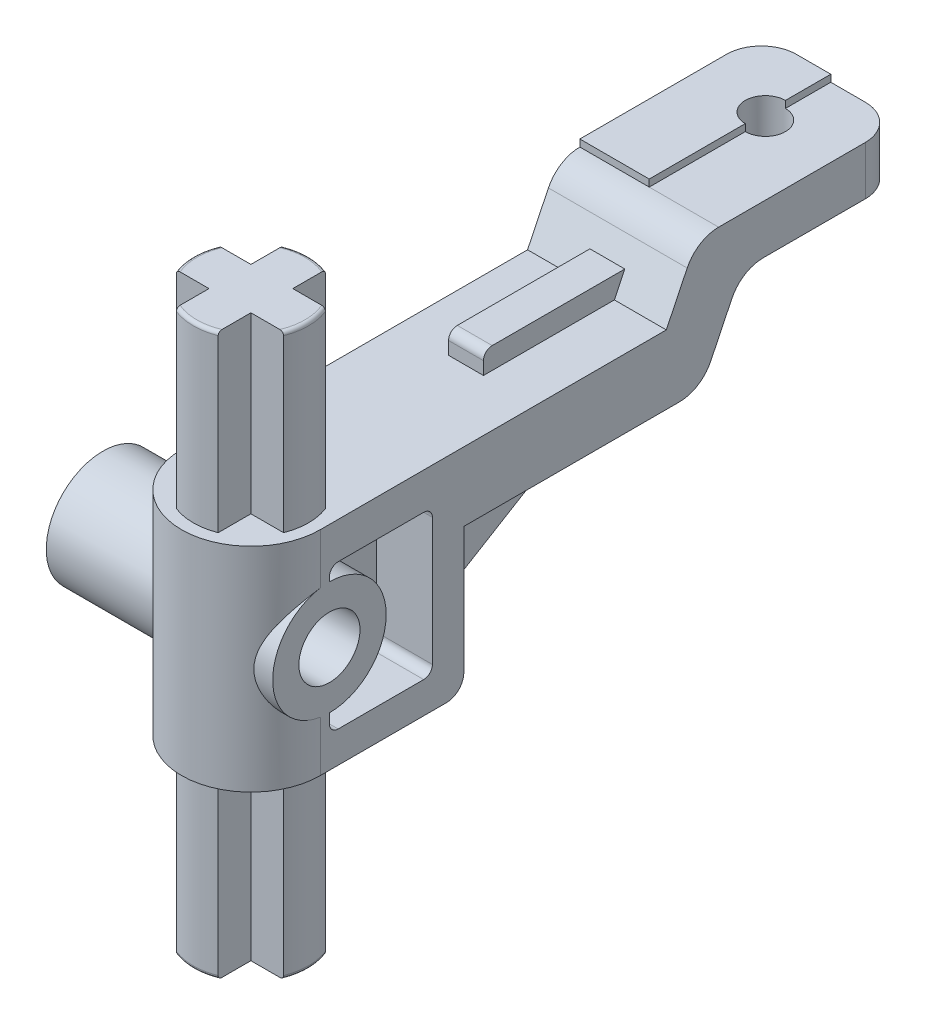
from build123d import *

# Parameters (mm, degrees)
SALIENTE_EXTRUIR1_DEPTH             = 7.95
CORTAR_EXTRUIR1_DEPTH               = 42.190806013
SALIENTE_EXTRUIR2_DEPTH             = 0.95
REDONDEO1_R                         = 2
CROQUIS5_W                          = 8.098391508
CROQUIS5_H                          = 3
SALIENTE_EXTRUIR3_DEPTH             = 1
REDONDEO2_R                         = 0.5
REDONDEO3_R                         = 1
SALIENTE_EXTRUIR5_DEPTH             = 16.075
SALIENTE_EXTRUIR6_START             = -2.8
SALIENTE_EXTRUIR6_DEPTH             = 3.2
REDONDEO4_R                         = 2
CORTAR_EXTRUIR2_REACH               = 48.175
CROQUIS9_R                          = 1.35
REDONDEO5_R                         = 0.2
CROQUIS10_R                         = 3.25
SALIENTE_EXTRUIR7_DEPTH             = 9
SALIENTE_EXTRUIR7_DIRECTION_2_REACH = 45.49
CORTAR_EXTRUIR3_DEPTH               = 3.2
REDONDEO6_R                         = 0.5
REDONDEO6_OF_SIMETR_A4_R            = 0.5
CORTAR_EXTRUIR4_REACH               = 47.21
CROQUIS12_R                         = 1.75
CROQUIS13_W                         = 41.090174937
CROQUIS13_H                         = 34.933198672
CORTAR_EXTRUIR5_DEPTH               = 33
SALIENTE_EXTRUIR8_START             = -3.2
CROQUIS14_R                         = 1.35
SALIENTE_EXTRUIR8_DEPTH             = 3.2
CROQUIS15_W                         = 1.853707792
CROQUIS15_H                         = 4.639411735
CORTAR_EXTRUIR6_DEPTH               = 0.4
CORTAR_EXTRUIR7_START               = -3.2
CROQUIS16_R                         = 1.15
CORTAR_EXTRUIR7_DEPTH               = 3.2


with BuildPart() as part:
    # Croquis1 → Saliente-Extruir1 (new body)
    with BuildSketch(Plane(origin=(0, 0, 0), x_dir=(0, 0, -1), z_dir=(1, 0, 0))):
        Polygon((0, 0), (0, 12.2), (23.8, 12.2), (25.543157895, 15.8), (37.2, 15.8), (37.2, 13), (28.1, 13), (25.8, 8.25), (12.2, 8.25), (12.2, 0), align=None)
    extrude(amount=SALIENTE_EXTRUIR1_DEPTH)

    # Croquis2 → Cortar-Extruir1 (cut, through all)
    with BuildSketch(Plane(origin=(0, 15.8, 0), x_dir=(1, 0, 0), z_dir=(0, 1, 0))):
        with BuildLine():
            Line((0, 3.975), (0, -1.023351504))
            Line((0, -1.023351504), (7.95, -1.023351504))
            Line((7.95, -1.023351504), (7.95, 3.975))
            ThreePointArc((7.95, 3.975), (3.975, 0), (0, 3.975))
        make_face()
    extrude(amount=-CORTAR_EXTRUIR1_DEPTH, mode=Mode.SUBTRACT)

    # Croquis3 → Saliente-Extruir2 (add, symmetric)
    with BuildSketch(Plane.ZY.offset(-3.975)):
        Polygon((-23.8, 8.25), (-12.2, 1.25), (-12.2, 8.25), align=None)
    extrude(amount=SALIENTE_EXTRUIR2_DEPTH, both=True)

    # Redondeo1
    redondeo1_edges = [part.edges().sort_by_distance(p)[0] for p in [
        (0, 14.4, -37.2),
        (3.975, 15.8, -25.543157895),
        (3.975, 13, -28.1),
        (3.975, 8.25, -25.8),
        (7.95, 14.4, -37.2),
    ]]
    fillet(redondeo1_edges, radius=REDONDEO1_R)

    # Croquis5 → Saliente-Extruir3 (add, symmetric)
    with BuildSketch(Plane.ZY.offset(-3.975)):
        with Locations((-20.349195754, 11.935808548)):
            Rectangle(CROQUIS5_W, CROQUIS5_H)
    extrude(amount=SALIENTE_EXTRUIR3_DEPTH, both=True)

    # Redondeo2
    redondeo2_edges = [part.edges().sort_by_distance(p)[0] for p in [
        (3.975, 13.435808548, -16.3),
    ]]
    fillet(redondeo2_edges, radius=REDONDEO2_R)

    # Redondeo3
    redondeo3_edges = [part.edges().sort_by_distance(p)[0] for p in [
        (3.975, 0, -12.2),
    ]]
    fillet(redondeo3_edges, radius=REDONDEO3_R)

    # Croquis6 → Saliente-Extruir5 (add, symmetric)
    with BuildSketch(Plane(origin=(0, 6.1, 0), x_dir=(1, 0, 0), z_dir=(0, 1, 0))):
        with BuildLine():
            Line((2.775, 7.04908523), (2.775, 5.175))
            Line((2.775, 5.175), (0.90091477, 5.175))
            ThreePointArc((0.90091477, 5.175), (0.675, 3.975), (0.90091477, 2.775))
            Line((0.90091477, 2.775), (2.775, 2.775))
            Line((2.775, 2.775), (2.775, 0.90091477))
            ThreePointArc((2.775, 0.90091477), (3.975, 0.675), (5.175, 0.90091477))
            Line((5.175, 0.90091477), (5.175, 2.775))
            Line((5.175, 2.775), (7.04908523, 2.775))
            ThreePointArc((7.04908523, 2.775), (7.275, 3.975), (7.04908523, 5.175))
            Line((7.04908523, 5.175), (5.175, 5.175))
            Line((5.175, 5.175), (5.175, 7.04908523))
            ThreePointArc((5.175, 7.04908523), (3.975, 7.275), (2.775, 7.04908523))
        make_face()
    extrude(amount=SALIENTE_EXTRUIR5_DEPTH, both=True)

    # Croquis8 → Saliente-Extruir6 (add)
    with BuildSketch(Plane(origin=(0, 15.8, 0), x_dir=(1, 0, 0), z_dir=(0, 1, 0)).offset(SALIENTE_EXTRUIR6_START)):
        Polygon((3.975, 37.2), (5.95, 37.2), (7.95, 37.2), (7.95, 26.796861802), (3.975, 26.796861802), align=None)
    extrude(amount=SALIENTE_EXTRUIR6_DEPTH)

    # Redondeo4
    redondeo4_edges = [part.edges().sort_by_distance(p)[0] for p in [
        (7.95, 14.6, -37.2),
    ]]
    fillet(redondeo4_edges, radius=REDONDEO4_R)

    # Croquis9 → Cortar-Extruir2 (cut, up to next)
    with BuildSketch(Plane(origin=(0, 16.2, 0), x_dir=(1, 0, 0), z_dir=(0, 1, 0)), mode=Mode.PRIVATE) as cortar_extruir2_sk1:
        with Locations(Location((3.975, 33.45, 0), (0, 0, 270))):
            Circle(CROQUIS9_R)
    cortar_extruir2_tool1 = extrude(cortar_extruir2_sk1.sketch, amount=-CORTAR_EXTRUIR2_REACH, mode=Mode.PRIVATE) & part.part
    add(cortar_extruir2_tool1.solids().sort_by_distance((3.975, 16.2, -33.45))[0], mode=Mode.SUBTRACT)

    # Redondeo5
    redondeo5_edges = [part.edges().sort_by_distance(p)[0] for p in [
        (3.975, -9.975, -7.275),
        (0.675, -9.975, -3.975),
        (3.975, -9.975, -0.675),
        (7.275, -9.975, -3.975),
        (3.975, 22.175, -7.275),
        (0.675, 22.175, -3.975),
        (3.975, 22.175, -0.675),
        (7.275, 22.175, -3.975),
    ]]
    fillet(redondeo5_edges, radius=REDONDEO5_R)

    # Croquis10 → Saliente-Extruir7 (add)
    with BuildSketch(Plane(origin=(3.975, 0, 0), x_dir=(0, 0, -1), z_dir=(1, 0, 0))):
        with Locations((4.5, 6.1)):
            Circle(CROQUIS10_R)
    extrude(amount=SALIENTE_EXTRUIR7_DEPTH)

    # Saliente-Extruir7 direction 2: up to this face of the body (flat: up to its plane)
    saliente_extruir7_direction_2_end = Plane(part.part.faces().sort_by_distance((0, 8.735177915, -15.168906587))[0])
    # Croquis10 → Saliente-Extruir7 direction 2 (add, up to the picked face)
    with BuildSketch(Plane(origin=(3.975, 0, 0), x_dir=(0, 0, -1), z_dir=(1, 0, 0)), mode=Mode.PRIVATE) as saliente_extruir7_direction_2_sk1:
        with Locations((4.5, 6.1)):
            Circle(CROQUIS10_R)
    saliente_extruir7_direction_2_tool1 = split(extrude(saliente_extruir7_direction_2_sk1.sketch, amount=-SALIENTE_EXTRUIR7_DIRECTION_2_REACH, mode=Mode.PRIVATE), bisect_by=saliente_extruir7_direction_2_end, keep=Keep.BOTH, mode=Mode.PRIVATE)
    add(saliente_extruir7_direction_2_tool1.solids().sort_by(Axis((3.975, 6.1, -4.5), (-1, 0, 0)))[0])

    # Croquis11 → Cortar-Extruir3 (cut)
    with BuildSketch(Plane.ZY):
        with BuildLine():
            Line((-10.4, 10.1), (-4.5, 10.1))
            Line((-4.5, 10.1), (-4.5, 9.35))
            ThreePointArc((-4.5, 9.35), (-7.75, 6.1), (-4.5, 2.85))
            Line((-4.5, 2.85), (-4.5, 1.8))
            Line((-4.5, 1.8), (-10.4, 1.8))
            Line((-10.4, 1.8), (-10.4, 10.1))
        make_face()
    cortar_extruir3 = extrude(amount=-CORTAR_EXTRUIR3_DEPTH, mode=Mode.SUBTRACT)

    # Redondeo6
    redondeo6_edges = [part.edges().sort_by_distance(p)[0] for p in [
        (1.6, 1.8, -10.4),
        (1.6, 10.1, -10.4),
        (1.6, 10.1, -4.5),
        (1.6, 1.8, -4.5),
    ]]
    fillet(redondeo6_edges, radius=REDONDEO6_R)

    # Simetría4: Cortar-Extruir3 across plane
    add(cortar_extruir3.mirror(Plane(origin=(3.975, 0, 0), x_dir=(0, 0, 1), z_dir=(1, 0, 0))), mode=Mode.SUBTRACT)

    # Redondeo6 of Simetría4
    redondeo6_of_simetr_a4_edges = [part.edges().sort_by_distance(p)[0] for p in [
        (6.35, 1.8, -10.4),
        (6.35, 10.1, -10.4),
        (6.35, 10.1, -4.5),
        (6.35, 1.8, -4.5),
    ]]
    fillet(redondeo6_of_simetr_a4_edges, radius=REDONDEO6_OF_SIMETR_A4_R)

    # Croquis12 → Cortar-Extruir4 (cut, up to next)
    with BuildSketch(Plane(origin=(12.975, 0, 0), x_dir=(0, 0, -1), z_dir=(1, 0, 0)), mode=Mode.PRIVATE) as cortar_extruir4_sk1:
        with Locations((4.5, 6.1)):
            Circle(CROQUIS12_R)
    cortar_extruir4_tool1 = extrude(cortar_extruir4_sk1.sketch, amount=-CORTAR_EXTRUIR4_REACH, mode=Mode.PRIVATE) & part.part
    add(cortar_extruir4_tool1.solids().sort_by_distance((12.975, 6.1, -4.5))[0], mode=Mode.SUBTRACT)


with BuildPart() as body_2:
    # Simetría6: mirrored copy
    add(part.part.mirror(Plane.ZY.offset(10)))

    # Croquis14 → Saliente-Extruir8 (add)
    with BuildSketch(Plane(origin=(0, 16.2, 0), x_dir=(1, 0, 0), z_dir=(0, 1, 0)).offset(SALIENTE_EXTRUIR8_START)):
        with Locations((-23.975, 33.45)):
            Circle(CROQUIS14_R)
    extrude(amount=SALIENTE_EXTRUIR8_DEPTH)

    # Croquis15 → Cortar-Extruir6 (cut)
    with BuildSketch(Plane(origin=(0, 16.2, 0), x_dir=(1, 0, 0), z_dir=(0, 1, 0))):
        with Locations((-23.048146104, 33.461340578)):
            Rectangle(CROQUIS15_W, CROQUIS15_H)
    extrude(amount=-CORTAR_EXTRUIR6_DEPTH, mode=Mode.SUBTRACT)

    # Croquis16 → Cortar-Extruir7 (cut)
    with BuildSketch(Plane(origin=(0, 16.2, 0), x_dir=(1, 0, 0), z_dir=(0, 1, 0)).offset(CORTAR_EXTRUIR7_START)):
        with Locations(Location((-23.975, 33.45, 0), (0, 0, 270))):
            Circle(CROQUIS16_R)
    extrude(amount=CORTAR_EXTRUIR7_DEPTH, mode=Mode.SUBTRACT)


with BuildPart() as part_1:
    add(part.part)

    # Croquis13 → Cortar-Extruir5 (cut)
    with BuildSketch(Plane(origin=(-10, 0, 0), x_dir=(0, 0, -1), z_dir=(1, 0, 0))):
        with Locations((19.577078705, 6.209166246)):
            Rectangle(CROQUIS13_W, CROQUIS13_H)
    extrude(amount=CORTAR_EXTRUIR5_DEPTH, mode=Mode.SUBTRACT)


solid = body_2.part
